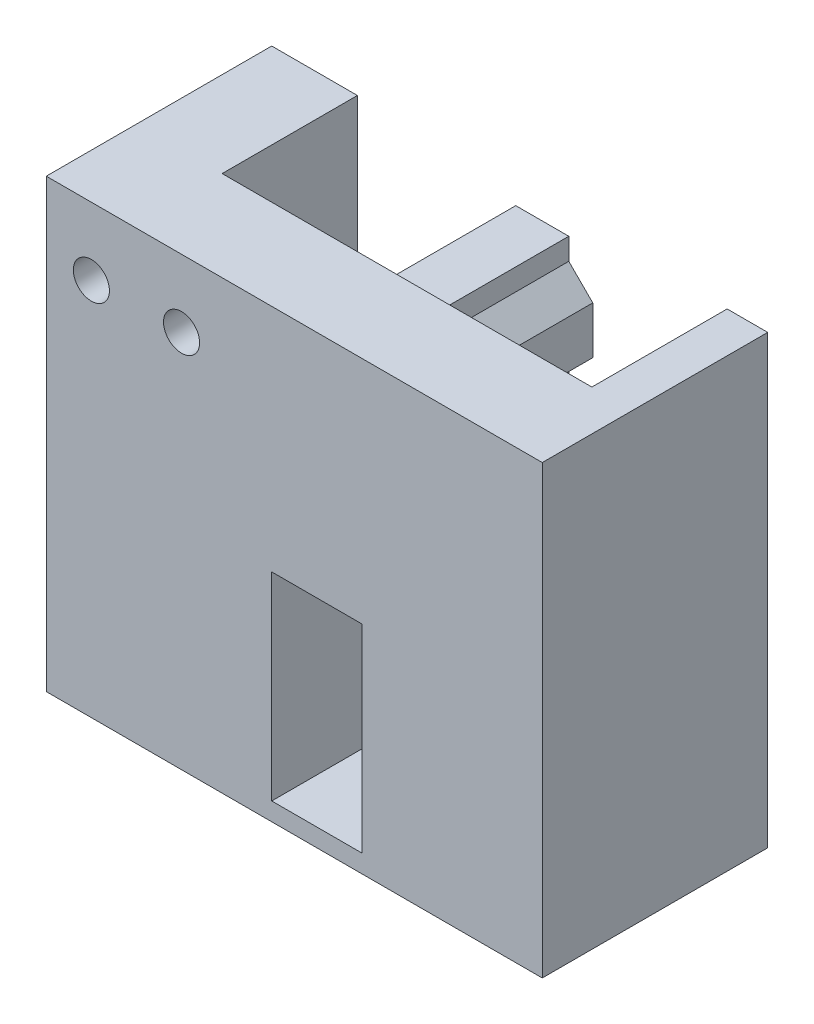
from build123d import *

# Parameters (mm, degrees)
BOSS_EXTRUDE1_DEPTH = 15
SKETCH3_W           = 55
SKETCH3_H           = 49.5
BOSS_EXTRUDE2_DEPTH = 10
BOSS_EXTRUDE3_DEPTH = 15
SKETCH5_R           = 2
CUT_EXTRUDE1_DEPTH  = 7
SKETCH6_R           = 2
CUT_EXTRUDE2_DEPTH  = 7
SKETCH7_W           = 10
SKETCH7_H           = 22
CUT_EXTRUDE3_DEPTH  = 43


with BuildPart() as part:
    # Sketch1 → Boss-Extrude1 (new body)
    with BuildSketch(Plane.XY):
        Polygon((15, -20), (-40, -20), (-40, 29.5), (-30.5, 29.5), (-30.5, 10), (-30.5, 3.494427191), (-29.7, 2.6), (-27.7, 2.6), (-27.7, 5), (-26.767766953, 5), (-24.4, 2.632233047), (-24.4, -2.783060843), (-26.767766953, -5), (-27.7, -5), (-27.7, -2.6), (-29.7, -2.6), (-30.5, -3.494427191), (-30.5, -10.5), (10.5, -10.5), (10.5, -3.494427191), (9.7, -2.6), (7.7, -2.6), (7.7, -5), (6.767766953, -5), (4.4, -2.783060843), (4.4, 2.632233047), (6.767766953, 5), (7.7, 5), (7.7, 2.6), (9.7, 2.6), (10.5, 3.494427191), (10.5, 10), (10.5, 29.5), (15, 29.5), align=None)
    extrude(amount=-BOSS_EXTRUDE1_DEPTH)

    # Sketch3 → Boss-Extrude2 (add)
    with BuildSketch(Plane.XY):
        with Locations((-12.5, 4.75)):
            Rectangle(SKETCH3_W, SKETCH3_H)
    extrude(amount=BOSS_EXTRUDE2_DEPTH)

    # Sketch5 → Cut-Extrude1 (cut)
    with BuildSketch(Plane.XY.offset(10)):
        with Locations((-35, 22)):
            Circle(SKETCH5_R)
        with Locations((-25, 22)):
            Circle(SKETCH5_R)
    extrude(amount=-CUT_EXTRUDE1_DEPTH, mode=Mode.SUBTRACT)

    # Sketch6 → Cut-Extrude2 (cut)
    with BuildSketch(Plane(origin=(0, -20, 0), x_dir=(-1, 0, 0), z_dir=(0, -1, 0))):
        with Locations(Location((35, -1, 0), (0, 0, 180))):
            Circle(SKETCH6_R)
        with Locations(Location((25, -1, 0), (0, 0, 180))):
            Circle(SKETCH6_R)
    extrude(amount=-CUT_EXTRUDE2_DEPTH, mode=Mode.SUBTRACT)

    # Sketch7 → Cut-Extrude3 (cut)
    with BuildSketch(Plane.XY.offset(10)):
        with Locations((-10, -7)):
            Rectangle(SKETCH7_W, SKETCH7_H)
    extrude(amount=-CUT_EXTRUDE3_DEPTH, mode=Mode.SUBTRACT)


with BuildPart() as body_2:
    # Sketch4 → Boss-Extrude3 (new body)
    with BuildSketch(Plane(origin=(0, 0, 0), x_dir=(-1, 0, 0), z_dir=(0, 0, -1))):
        Polygon((12.939339828, 25.292893219), (15.6, 22.632233047), (15.6, 17.367766953), (12.939339828, 14.707106781), (12.939339828, 12.3), (7.060660172, 12.3), (7.060660172, 14.707106781), (4.4, 17.367766953), (4.4, 22.632233047), (7.060660172, 25.292893219), (7.060660172, 27.7), (12.939339828, 27.7), align=None)
    extrude(amount=BOSS_EXTRUDE3_DEPTH)


solid = Compound([part.part, body_2.part])
